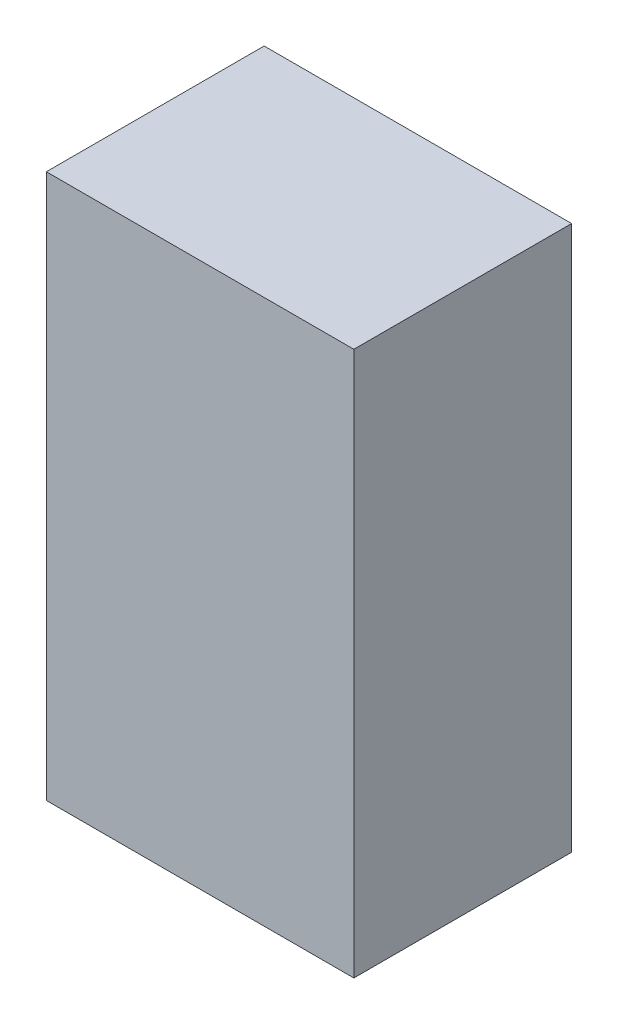
from build123d import *

# Parameters (mm, degrees)
SKETCH_1_W      = 48
SKETCH_1_H      = 85
EXTRUDE_1_DEPTH = 34


with BuildPart() as part:
    # 草图1 → 凸台-拉伸1 (new body)
    with BuildSketch(Plane.XY):
        with Locations((24, -42.5)):
            Rectangle(SKETCH_1_W, SKETCH_1_H)
    extrude(amount=EXTRUDE_1_DEPTH)


solid = part.part
